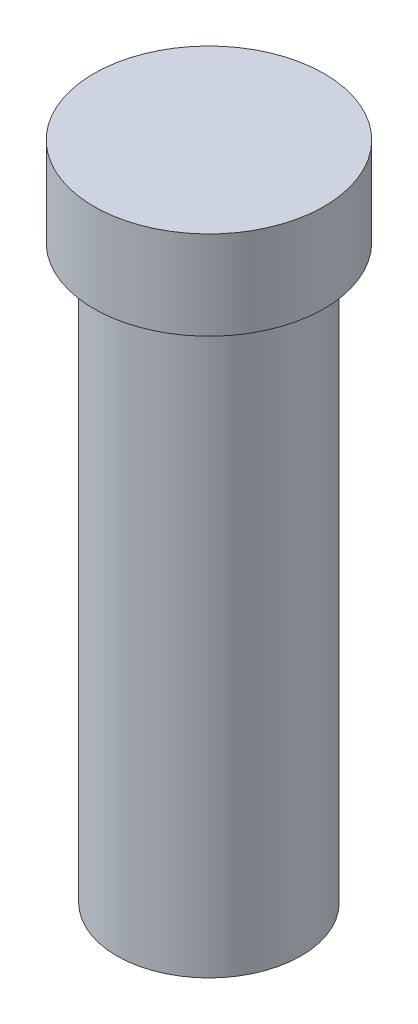
from build123d import *


with BuildPart() as part:
    # Sketch1 → Revolve1 (revolve)
    with BuildSketch(Plane.XY, mode=Mode.PRIVATE) as revolve1_sk:
        Polygon((0, 0), (6.5, 0), (6.5, -5), (5.2, -5), (5.2, -37.3), (0, -37.3), align=None)
    revolve(revolve1_sk.sketch.rotate(Axis((0, -42.3, 0), (0, 1, 0)), 90), axis=Axis((0, -42.3, 0), (0, 1, 0)))


solid = part.part
